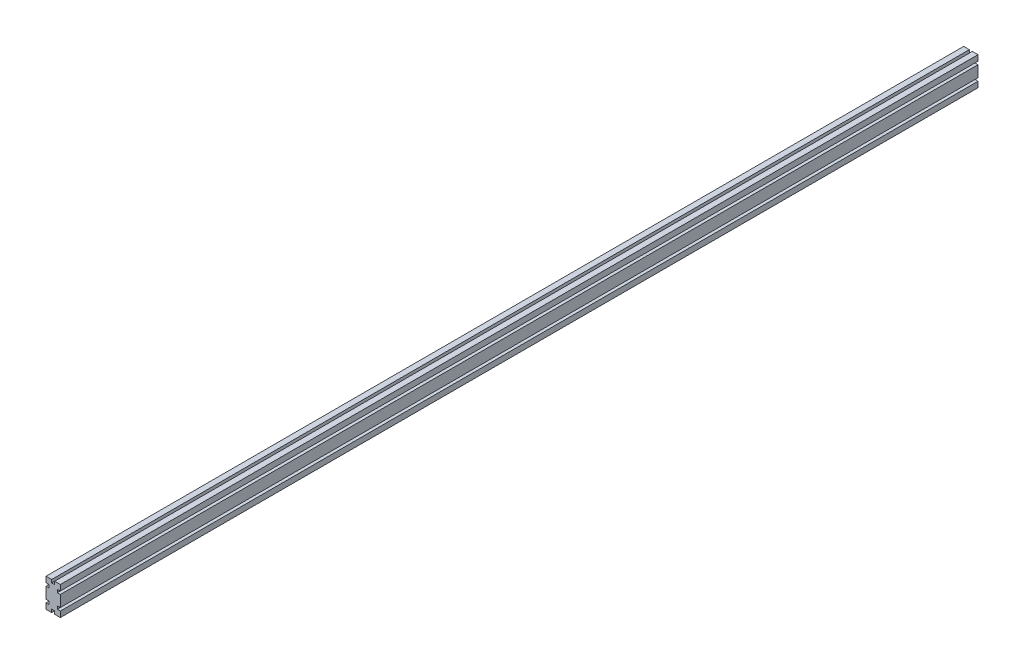
from build123d import *

# Parameters (mm, degrees)
PROFILE_DEPTH = 2438.4


with BuildPart() as part:
    # Sketch1 → Profile (new body)
    with BuildSketch(Plane.XY):
        Polygon((-19.05, -38.1), (-4, -38.1), (-4, -30.1), (4, -30.1), (4, -38.1), (19.05, -38.1), (19.05, -23.05), (11.05, -23.05), (11.05, -15.05), (19.05, -15.05), (19.05, 15.05), (11.05, 15.05), (11.05, 23.05), (19.05, 23.05), (19.05, 38.1), (4, 38.1), (4, 30.1), (-4, 30.1), (-4, 38.1), (-19.05, 38.1), (-19.05, 23.05), (-11.05, 23.05), (-11.05, 15.05), (-19.05, 15.05), (-19.05, -15.05), (-11.05, -15.05), (-11.05, -23.05), (-19.05, -23.05), align=None)
    extrude(amount=PROFILE_DEPTH)


solid = part.part
